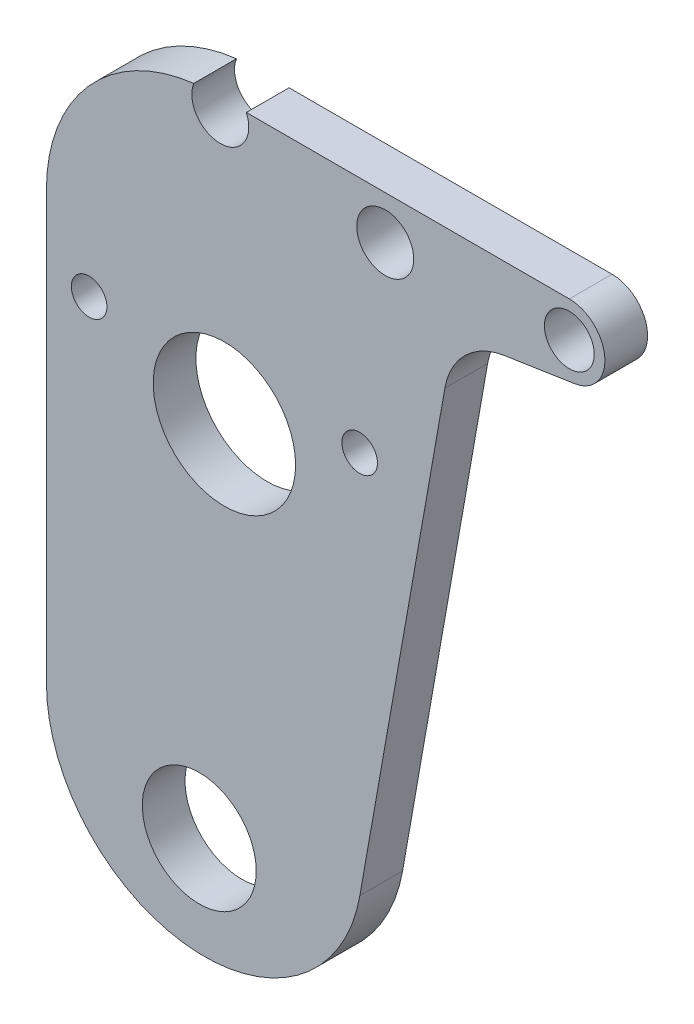
from build123d import *

# Parameters (mm, degrees)
SKETCH3_R           = 4
BOSS_EXTRUDE4_DEPTH = 3
SKETCH5_R           = 1.25
SKETCH5_R_2         = 5
CUT_EXTRUDE2_DEPTH  = 38.912717898
SKETCH6_R           = 1.75
CUT_EXTRUDE3_DEPTH  = 38.912717898
SKETCH8_R           = 2
CUT_EXTRUDE4_DEPTH  = 38.912717898


with BuildPart() as part:
    # Sketch3 → Boss-Extrude4 (new body)
    with BuildSketch(Plane.XY):
        with BuildLine():
            Line((-12.5, -15), (-12.5, 15))
            ThreePointArc((-12.5, 15), (-9.066038179, 23.290317201), (-0.775720978, 26.724279022))
            Line((-0.775720978, 26.724279022), (24.224279022, 26.724279022))
            ThreePointArc((24.224279022, 26.724279022), (26.717166406, 24.412726597), (24.600101889, 21.752689013))
            Line((24.600101889, 21.752689013), (19.656921871, 21.001043278))
            ThreePointArc((19.656921871, 21.001043278), (16.915054922, 19.634924783), (15.48452884, 16.926104149))
            Line((15.48452884, 16.926104149), (9.51547116, -16.926104149))
            ThreePointArc((9.51547116, -16.926104149), (-2.374739058, -26.049783342), (-12.5, -15))
        make_face()
        with Locations((-1.764648859, -19.076420455)):
            Circle(SKETCH3_R, mode=Mode.SUBTRACT)
    extrude(amount=BOSS_EXTRUDE4_DEPTH)

    # Sketch5 → Cut-Extrude2 (cut, through all)
    with BuildSketch(Plane.XY.offset(3)):
        with Locations((-9.5, 10)):
            Circle(SKETCH5_R)
        with Locations((9.5, 10)):
            Circle(SKETCH5_R)
        with Locations((0, 7)):
            Circle(SKETCH5_R_2)
    extrude(amount=-CUT_EXTRUDE2_DEPTH, mode=Mode.SUBTRACT)

    # Sketch6 → Cut-Extrude3 (cut, through all)
    with BuildSketch(Plane.XY.offset(3)):
        with Locations((24.224279022, 24.224279022)):
            Circle(SKETCH6_R)
    extrude(amount=-CUT_EXTRUDE3_DEPTH, mode=Mode.SUBTRACT)

    # Sketch8 → Cut-Extrude4 (cut, through all)
    with BuildSketch(Plane.XY.offset(3)):
        with Locations((11.295409365, 23.680851427)):
            Circle(SKETCH8_R)
        with Locations((-0.289384278, 25.919731906)):
            Circle(SKETCH8_R)
    extrude(amount=-CUT_EXTRUDE4_DEPTH, mode=Mode.SUBTRACT)


solid = part.part
